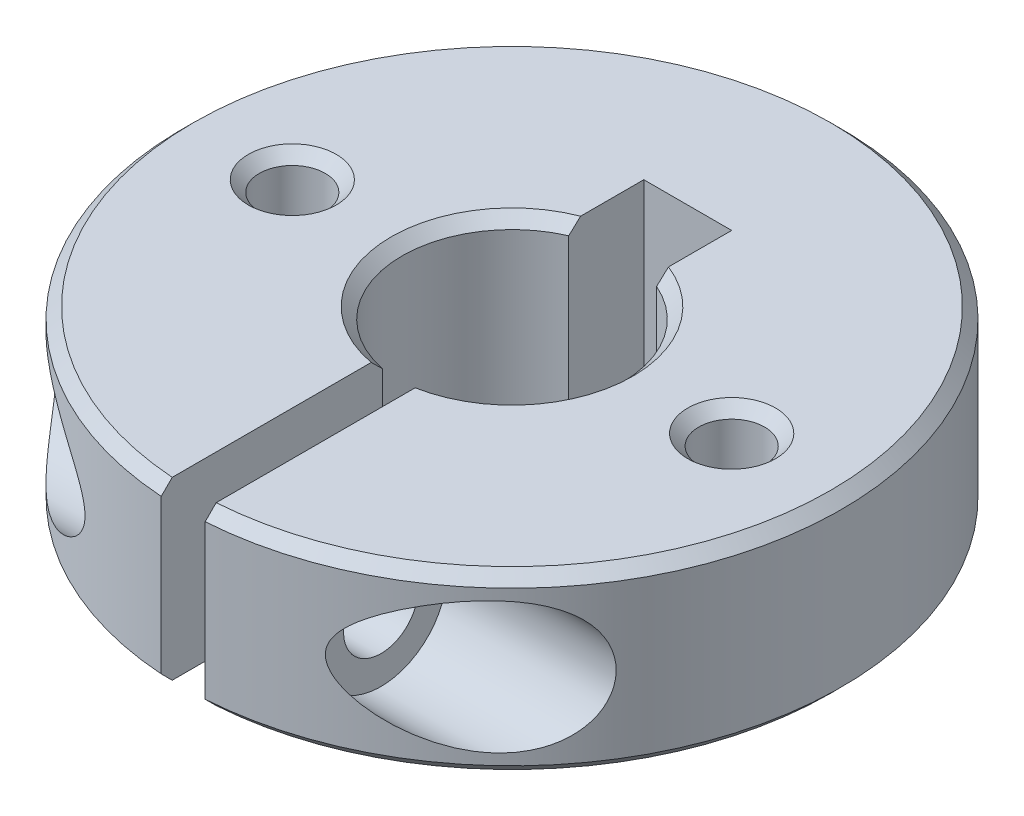
from build123d import *

# Parameters (mm, degrees)
SKETCH_1_R               = 15
SKETCH_1_R_2             = 5
EXTRUDE_1_DEPTH          = 8
SKETCH_2_W               = 4
SKETCH_2_H               = 4
CUT_EXTRUDE_1_DEPTH      = 23.671568098
SKETCH_3_W               = 2
SKETCH_3_H               = 20
CUT_EXTRUDE_2_DEPTH      = 23.671568098
CUT_EXTRUDE_3_DEPTH      = 23.671568098
CUT_EXTRUDE_3_DEPTH_BACK = 23.671568098
SKETCH_4_R               = 1.7
SKETCH_5_R               = 3
CUT_EXTRUDE_4_DEPTH      = 10
SKETCH_6_R               = 1.5
CUT_EXTRUDE_5_DEPTH      = 23.671568265
CHAMFER_1_SIZE           = 0.5


with BuildPart() as part:
    # 草图1 → 凸台-拉伸1 (new body)
    with BuildSketch(Plane(origin=(0, 0, 0), x_dir=(1, 0, 0), z_dir=(0, 1, 0))):
        with Locations(Location((0, 0, 0), (0, 0, 270))):
            Circle(SKETCH_1_R)
        with Locations(Location((0, 0, 0), (0, 0, 270))):
            Circle(SKETCH_1_R_2, mode=Mode.SUBTRACT)
    extrude(amount=EXTRUDE_1_DEPTH)

    # 草图2 → 切除-拉伸1 (cut, through all)
    with BuildSketch(Plane(origin=(0, 8, 0), x_dir=(1, 0, 0), z_dir=(0, 1, 0))):
        with Locations((0, 6)):
            Rectangle(SKETCH_2_W, SKETCH_2_H)
    extrude(amount=-CUT_EXTRUDE_1_DEPTH, mode=Mode.SUBTRACT)

    # 草图3 → 切除-拉伸2 (cut, through all)
    with BuildSketch(Plane(origin=(0, 8, 0), x_dir=(1, 0, 0), z_dir=(0, 1, 0))):
        with Locations((0, -5)):
            Rectangle(SKETCH_3_W, SKETCH_3_H)
    extrude(amount=-CUT_EXTRUDE_2_DEPTH, mode=Mode.SUBTRACT)

    # 草图4 → 切除-拉伸3 (cut, two sides: drawn at the far end of the back side and taken through both)
    with BuildSketch(Plane(origin=(0, 0, 0), x_dir=(0, 0, -1), z_dir=(1, 0, 0)).offset(-CUT_EXTRUDE_3_DEPTH_BACK)):
        with Locations((-10.966629547, 4)):
            Circle(SKETCH_4_R)
    extrude(amount=CUT_EXTRUDE_3_DEPTH + CUT_EXTRUDE_3_DEPTH_BACK, mode=Mode.SUBTRACT)

    # 草图5 → 切除-拉伸4 (cut)
    with BuildSketch(Plane(origin=(15, 0, 0), x_dir=(0, 0, -1), z_dir=(1, 0, 0))):
        with Locations((-10.966629547, 4)):
            Circle(SKETCH_5_R)
    cut_extrude_4 = extrude(amount=-CUT_EXTRUDE_4_DEPTH, mode=Mode.SUBTRACT)

    # 镜向1: 切除-拉伸4 across plane
    add(cut_extrude_4.mirror(Plane(origin=(0, 0, 0), x_dir=(0, 0, 1), z_dir=(1, 0, 0))), mode=Mode.SUBTRACT)

    # 草图6 → 切除-拉伸5 (cut, through all)
    with BuildSketch(Plane(origin=(0, 8, 0), x_dir=(1, 0, 0), z_dir=(0, 1, 0))):
        with Locations(Location((10, 0, 0), (0, 0, 270))):
            Circle(SKETCH_6_R)
        with Locations(Location((-10, 0, 0), (0, 0, 90))):
            Circle(SKETCH_6_R)
    extrude(amount=-CUT_EXTRUDE_5_DEPTH, mode=Mode.SUBTRACT)

    # 倒角1
    chamfer_1_edges = [part.edges().sort_by_distance(p)[0] for p in [
        (-4.972421157, 0, 0.524430968),
        (4.972421157, 0, 0.524430968),
        (4.972421157, 8, 0.524430968),
        (0, 8, -15),
        (0, 0, -15),
        (10, 0, -1.5),
        (10, 8, -1.5),
        (-10, 0, 1.5),
        (-10, 8, 1.5),
        (-4.972421157, 8, 0.524430968),
    ]]
    chamfer(chamfer_1_edges, length=CHAMFER_1_SIZE)


solid = part.part
